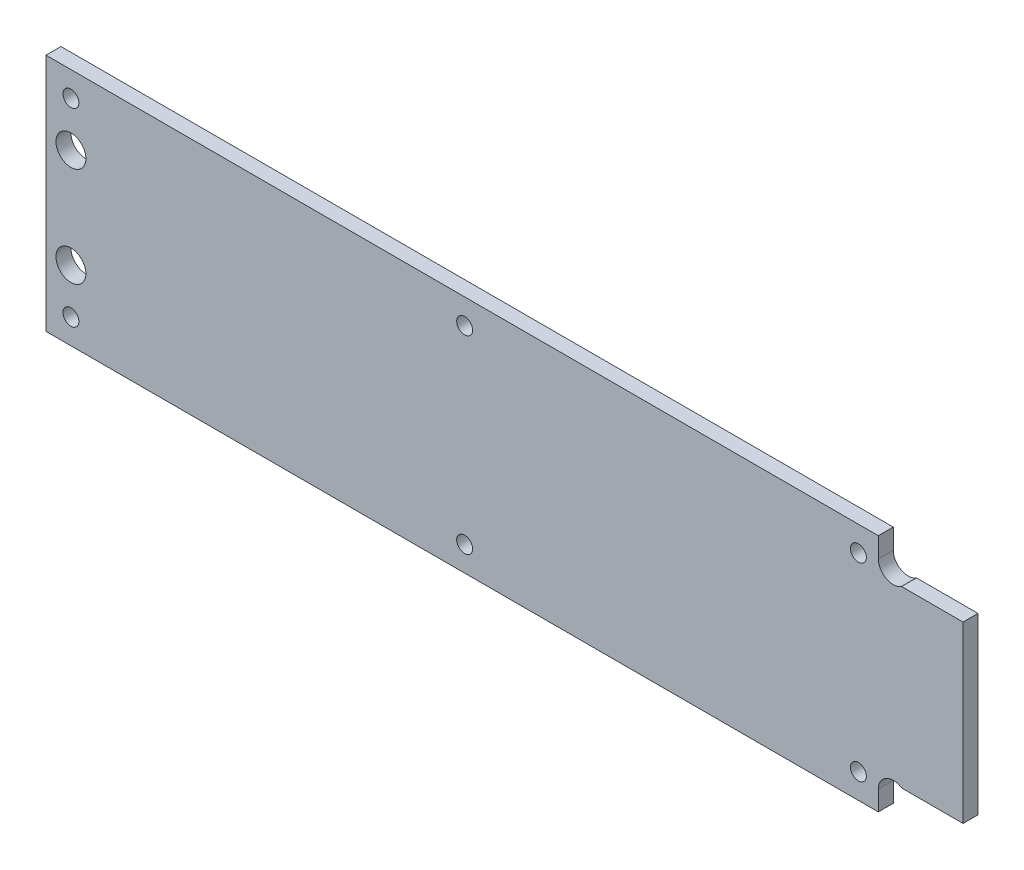
from build123d import *

# Parameters (mm, degrees)
SKETCH1_R           = 3
BOSS_EXTRUDE1_DEPTH = 3
BOSS_EXTRUDE2_DEPTH = 2
CHAMFER1_SIZE       = 0.5
FILLET1_R           = 1
SKETCH3_R           = 1.6
CUT_EXTRUDE1_DEPTH  = 103.961157725


with BuildPart() as part:
    # Sketch1 → Boss-Extrude1 (new body)
    with BuildSketch(Plane.XY):
        with BuildLine():
            Line((87.658312395, -17.5), (100, -17.5))
            Line((100, -17.5), (100, 17.5))
            Line((100, 17.5), (87.658312395, 17.5))
            ThreePointArc((87.658312395, 17.5), (84.581362835, 17.356617963), (83, 20))
            Line((83, 20), (83, 24))
            Line((83, 24), (-84, 24))
            Line((-84, 24), (-84, -24))
            Line((-84, -24), (83, -24))
            Line((83, -24), (83, -20))
            ThreePointArc((83, -20), (84.581362835, -17.356617963), (87.658312395, -17.5))
        make_face()
        with Locations((-79, -10)):
            Circle(SKETCH1_R, mode=Mode.SUBTRACT)
        with Locations((-79, 10)):
            Circle(SKETCH1_R, mode=Mode.SUBTRACT)
    extrude(amount=BOSS_EXTRUDE1_DEPTH)

    # Sketch2 → Boss-Extrude2 (add)
    with BuildSketch(Plane(origin=(0, 0, 0), x_dir=(-1, 0, 0), z_dir=(0, 0, -1))):
        with BuildLine():
            Line((-73.7, 20), (-73.7, 9.7))
            Line((-73.7, 9.7), (-77.3, 9.7))
            Line((-77.3, 9.7), (-77.3, 15.2))
            Line((-77.3, 15.2), (-97.7, 15.2))
            Line((-97.7, 15.2), (-97.7, -15.2))
            Line((-97.7, -15.2), (-77.3, -15.2))
            Line((-77.3, -15.2), (-77.3, -9.7))
            Line((-77.3, -9.7), (-73.7, -9.7))
            Line((-73.7, -9.7), (-73.7, -20))
            ThreePointArc((-73.7, -20), (-73.494974747, -20.494974747), (-73, -20.7))
            Line((-73, -20.7), (-6, -20.7))
            ThreePointArc((-6, -20.7), (-5.505025253, -20.494974747), (-5.3, -20))
            Line((-5.3, -20), (-5.3, -19))
            ThreePointArc((-5.3, -19), (0, -13.7), (5.3, -19))
            Line((5.3, -19), (5.3, -20))
            ThreePointArc((5.3, -20), (5.505025253, -20.494974747), (6, -20.7))
            Line((6, -20.7), (73, -20.7))
            ThreePointArc((73, -20.7), (73.494974747, -20.494974747), (73.7, -20))
            Line((73.7, -20), (73.7, 20))
            ThreePointArc((73.7, 20), (73.494974747, 20.494974747), (73, 20.7))
            Line((73, 20.7), (6, 20.7))
            ThreePointArc((6, 20.7), (5.505025253, 20.494974747), (5.3, 20))
            Line((5.3, 20), (5.3, 19))
            ThreePointArc((5.3, 19), (0, 13.7), (-5.3, 19))
            Line((-5.3, 19), (-5.3, 20))
            ThreePointArc((-5.3, 20), (-5.505025253, 20.494974747), (-6, 20.7))
            Line((-6, 20.7), (-73, 20.7))
            ThreePointArc((-73, 20.7), (-73.494974747, 20.494974747), (-73.7, 20))
        make_face()
        with BuildLine():
            Line((-7.293833012, 18.7), (-71.7, 18.7))
            Line((-71.7, 18.7), (-71.7, 7.7))
            Line((-71.7, 7.7), (-79.3, 7.7))
            Line((-79.3, 7.7), (-79.3, 13.2))
            Line((-79.3, 13.2), (-95.7, 13.2))
            Line((-95.7, 13.2), (-95.7, -13.2))
            Line((-95.7, -13.2), (-79.3, -13.2))
            Line((-79.3, -13.2), (-79.3, -7.7))
            Line((-79.3, -7.7), (-71.7, -7.7))
            Line((-71.7, -7.7), (-71.7, -18.7))
            Line((-71.7, -18.7), (-7.293833012, -18.7))
            ThreePointArc((-7.293833012, -18.7), (0, -11.7), (7.293833012, -18.7))
            Line((7.293833012, -18.7), (71.7, -18.7))
            Line((71.7, -18.7), (71.7, 18.7))
            Line((71.7, 18.7), (7.293833012, 18.7))
            ThreePointArc((7.293833012, 18.7), (0, 11.7), (-7.293833012, 18.7))
        make_face(mode=Mode.SUBTRACT)
    extrude(amount=BOSS_EXTRUDE2_DEPTH)

    # Chamfer1
    chamfer1_edges = [part.edges().sort_by_distance(p)[0] for p in [
        (73.494974747, 20.494974747, -2),
        (73.7, 14.85, -2),
        (75.5, 9.7, -2),
        (77.3, 12.45, -2),
        (87.5, 15.2, -2),
        (97.7, 0, -2),
        (87.5, -15.2, -2),
        (77.3, -12.45, -2),
        (75.5, -9.7, -2),
        (73.7, -14.85, -2),
        (73.494974747, -20.494974747, -2),
        (39.5, -20.7, -2),
        (5.505025253, -20.494974747, -2),
        (5.3, -19.5, -2),
        (0, -13.7, -2),
        (-5.3, -19.5, -2),
        (-5.505025253, -20.494974747, -2),
        (-39.5, -20.7, -2),
        (-73.494974747, -20.494974747, -2),
        (-73.7, 0, -2),
        (-73.494974747, 20.494974747, -2),
        (-39.5, 20.7, -2),
        (-5.505025253, 20.494974747, -2),
        (-5.3, 19.5, -2),
        (0, 13.7, -2),
        (5.3, 19.5, -2),
        (5.505025253, 20.494974747, -2),
        (39.5, 20.7, -2),
    ]]
    chamfer(chamfer1_edges, length=CHAMFER1_SIZE)

    # Fillet1
    fillet1_edges = [part.edges().sort_by_distance(p)[0] for p in [
        (0, 11.7, 0),
        (39.496916506, 18.7, 0),
        (71.7, 13.2, 0),
        (75.5, 7.7, 0),
        (79.3, 10.45, 0),
        (87.5, 13.2, 0),
        (95.7, 0, 0),
        (87.5, -13.2, 0),
        (79.3, -10.45, 0),
        (75.5, -7.7, 0),
        (71.7, -13.2, 0),
        (39.496916506, -18.7, 0),
        (0, -11.7, 0),
        (-39.496916506, -18.7, 0),
        (-71.7, 0, 0),
        (-39.496916506, 18.7, 0),
    ]]
    fillet(fillet1_edges, radius=FILLET1_R)

    # Sketch3 → Cut-Extrude1 (cut, through all)
    with BuildSketch(Plane.XY.offset(3)):
        with Locations((-79, 19)):
            Circle(SKETCH3_R)
        with Locations((-79, -19)):
            Circle(SKETCH3_R)
        with Locations((79, 19)):
            Circle(SKETCH3_R)
        with Locations((79, -19)):
            Circle(SKETCH3_R)
        with Locations((0, 19)):
            Circle(SKETCH3_R)
        with Locations((0, -19)):
            Circle(SKETCH3_R)
    extrude(amount=-CUT_EXTRUDE1_DEPTH, mode=Mode.SUBTRACT)


solid = part.part
